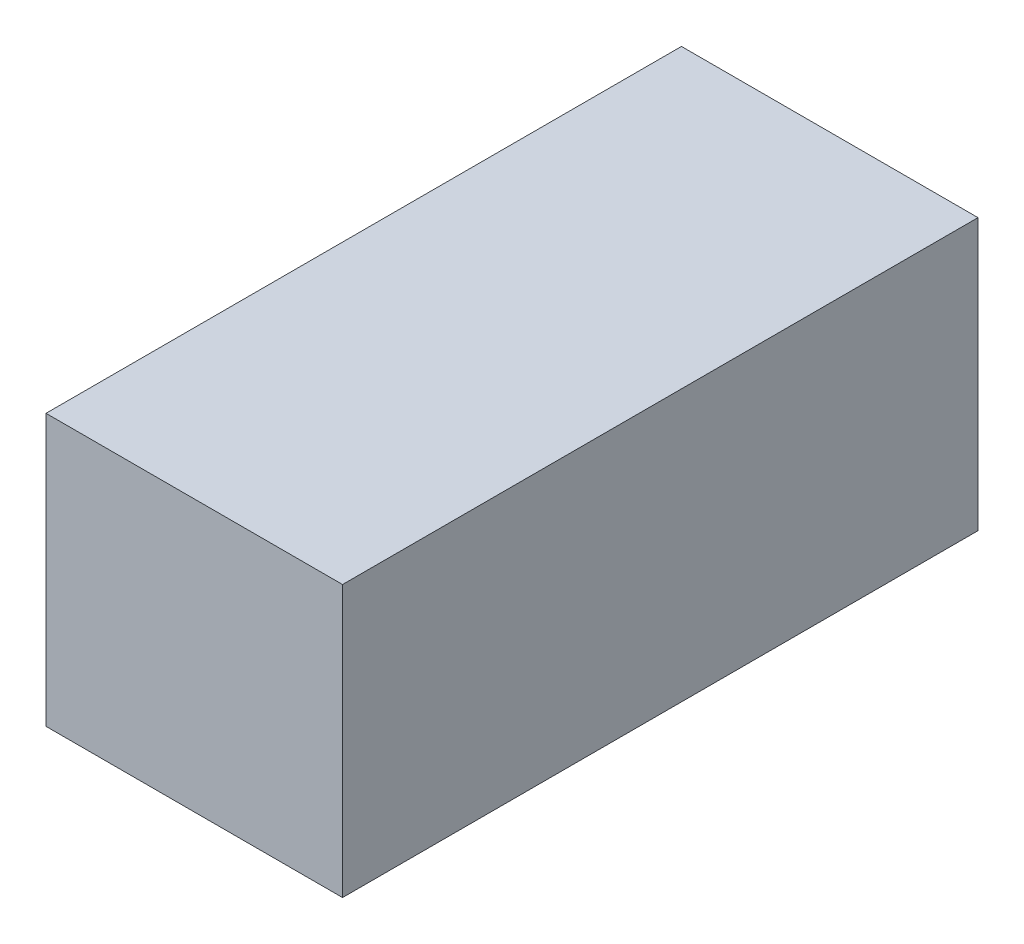
from build123d import *

# Parameters (mm, degrees)
SKETCH_1_W      = 35
SKETCH_1_H      = 75
EXTRUDE_1_DEPTH = 32


with BuildPart() as part:
    # Эскиз1 → Бобышка-Вытянуть1 (new body)
    with BuildSketch(Plane(origin=(0, 17, 0), x_dir=(1, 0, 0), z_dir=(0, 1, 0))):
        with Locations((0, -37.5)):
            Rectangle(SKETCH_1_W, SKETCH_1_H)
    extrude(amount=-EXTRUDE_1_DEPTH)


solid = part.part
